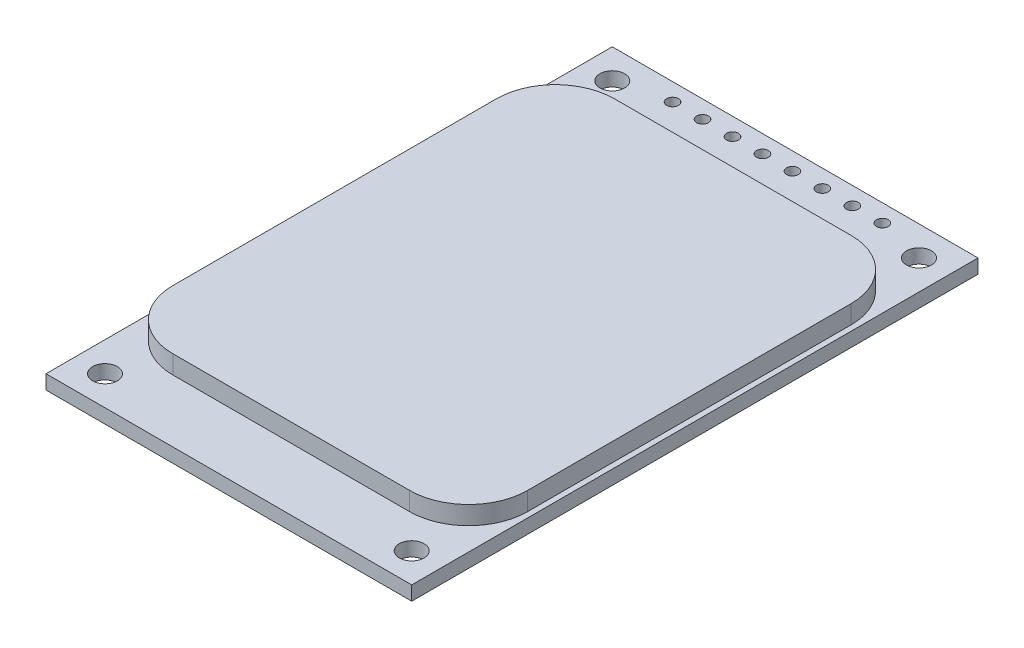
from build123d import *

# Parameters (mm, degrees)
SKETCH_1_W          = 31
SKETCH_1_H          = 48
EXTRUDE_1_DEPTH     = 1.2
CUT_EXTRUDE_1_REACH = 59.153
SKETCH_2_R          = 1.05
CUT_EXTRUDE_2_REACH = 59.153
SKETCH_3_R          = 0.5
SKETCH_4_W          = 30.07
SKETCH_4_H          = 37.43
EXTRUDE_2_DEPTH     = 1.56
FILLET_1_R          = 5


with BuildPart() as part:
    # 草图1 → 凸台-拉伸1 (new body)
    with BuildSketch(Plane(origin=(0, 0, 0), x_dir=(1, 0, 0), z_dir=(0, 1, 0))):
        with Locations((15.5, -24)):
            Rectangle(SKETCH_1_W, SKETCH_1_H)
    extrude(amount=EXTRUDE_1_DEPTH)

    # 草图2 → 切除-拉伸1 (cut, up to next)
    with BuildSketch(Plane(origin=(0, 1.2, 0), x_dir=(1, 0, 0), z_dir=(0, 1, 0)), mode=Mode.PRIVATE) as cut_extrude_1_sk1:
        with Locations(Location((2.5, -2.5, 0), (0, 0, 270))):
            Circle(SKETCH_2_R)
    cut_extrude_1_tool1 = extrude(cut_extrude_1_sk1.sketch, amount=-CUT_EXTRUDE_1_REACH, mode=Mode.PRIVATE) & part.part
    # 草图2 → 切除-拉伸1 (cut, up to next)
    with BuildSketch(Plane(origin=(0, 1.2, 0), x_dir=(1, 0, 0), z_dir=(0, 1, 0)), mode=Mode.PRIVATE) as cut_extrude_1_sk2:
        with Locations(Location((28.5, -2.5, 0), (0, 0, 270))):
            Circle(SKETCH_2_R)
    cut_extrude_1_tool2 = extrude(cut_extrude_1_sk2.sketch, amount=-CUT_EXTRUDE_1_REACH, mode=Mode.PRIVATE) & part.part
    # 草图2 → 切除-拉伸1 (cut, up to next)
    with BuildSketch(Plane(origin=(0, 1.2, 0), x_dir=(1, 0, 0), z_dir=(0, 1, 0)), mode=Mode.PRIVATE) as cut_extrude_1_sk3:
        with Locations(Location((2.5, -45.5, 0), (0, 0, 270))):
            Circle(SKETCH_2_R)
    cut_extrude_1_tool3 = extrude(cut_extrude_1_sk3.sketch, amount=-CUT_EXTRUDE_1_REACH, mode=Mode.PRIVATE) & part.part
    # 草图2 → 切除-拉伸1 (cut, up to next)
    with BuildSketch(Plane(origin=(0, 1.2, 0), x_dir=(1, 0, 0), z_dir=(0, 1, 0)), mode=Mode.PRIVATE) as cut_extrude_1_sk4:
        with Locations(Location((28.5, -45.5, 0), (0, 0, 270))):
            Circle(SKETCH_2_R)
    cut_extrude_1_tool4 = extrude(cut_extrude_1_sk4.sketch, amount=-CUT_EXTRUDE_1_REACH, mode=Mode.PRIVATE) & part.part
    add(cut_extrude_1_tool1.solids().sort_by_distance((2.5, 1.2, 2.5))[0], mode=Mode.SUBTRACT)
    add(cut_extrude_1_tool2.solids().sort_by_distance((28.5, 1.2, 2.5))[0], mode=Mode.SUBTRACT)
    add(cut_extrude_1_tool3.solids().sort_by_distance((2.5, 1.2, 45.5))[0], mode=Mode.SUBTRACT)
    add(cut_extrude_1_tool4.solids().sort_by_distance((28.5, 1.2, 45.5))[0], mode=Mode.SUBTRACT)

    # 草图3 → 切除-拉伸2 (cut, up to next)
    with BuildSketch(Plane(origin=(0, 1.2, 0), x_dir=(1, 0, 0), z_dir=(0, 1, 0)), mode=Mode.PRIVATE) as cut_extrude_2_sk1:
        with Locations(Location((14.23, -1.5, 0), (0, 0, 270))):
            Circle(SKETCH_3_R)
    cut_extrude_2_tool1 = extrude(cut_extrude_2_sk1.sketch, amount=-CUT_EXTRUDE_2_REACH, mode=Mode.PRIVATE) & part.part
    # 草图3 → 切除-拉伸2 (cut, up to next)
    with BuildSketch(Plane(origin=(0, 1.2, 0), x_dir=(1, 0, 0), z_dir=(0, 1, 0)), mode=Mode.PRIVATE) as cut_extrude_2_sk2:
        with Locations(Location((11.69, -1.5, 0), (0, 0, 270))):
            Circle(SKETCH_3_R)
    cut_extrude_2_tool2 = extrude(cut_extrude_2_sk2.sketch, amount=-CUT_EXTRUDE_2_REACH, mode=Mode.PRIVATE) & part.part
    # 草图3 → 切除-拉伸2 (cut, up to next)
    with BuildSketch(Plane(origin=(0, 1.2, 0), x_dir=(1, 0, 0), z_dir=(0, 1, 0)), mode=Mode.PRIVATE) as cut_extrude_2_sk3:
        with Locations(Location((9.15, -1.5, 0), (0, 0, 270))):
            Circle(SKETCH_3_R)
    cut_extrude_2_tool3 = extrude(cut_extrude_2_sk3.sketch, amount=-CUT_EXTRUDE_2_REACH, mode=Mode.PRIVATE) & part.part
    # 草图3 → 切除-拉伸2 (cut, up to next)
    with BuildSketch(Plane(origin=(0, 1.2, 0), x_dir=(1, 0, 0), z_dir=(0, 1, 0)), mode=Mode.PRIVATE) as cut_extrude_2_sk4:
        with Locations(Location((6.61, -1.5, 0), (0, 0, 270))):
            Circle(SKETCH_3_R)
    cut_extrude_2_tool4 = extrude(cut_extrude_2_sk4.sketch, amount=-CUT_EXTRUDE_2_REACH, mode=Mode.PRIVATE) & part.part
    # 草图3 → 切除-拉伸2 (cut, up to next)
    with BuildSketch(Plane(origin=(0, 1.2, 0), x_dir=(1, 0, 0), z_dir=(0, 1, 0)), mode=Mode.PRIVATE) as cut_extrude_2_sk5:
        with Locations(Location((24.39, -1.5, 0), (0, 0, 270))):
            Circle(SKETCH_3_R)
    cut_extrude_2_tool5 = extrude(cut_extrude_2_sk5.sketch, amount=-CUT_EXTRUDE_2_REACH, mode=Mode.PRIVATE) & part.part
    # 草图3 → 切除-拉伸2 (cut, up to next)
    with BuildSketch(Plane(origin=(0, 1.2, 0), x_dir=(1, 0, 0), z_dir=(0, 1, 0)), mode=Mode.PRIVATE) as cut_extrude_2_sk6:
        with Locations(Location((21.85, -1.5, 0), (0, 0, 270))):
            Circle(SKETCH_3_R)
    cut_extrude_2_tool6 = extrude(cut_extrude_2_sk6.sketch, amount=-CUT_EXTRUDE_2_REACH, mode=Mode.PRIVATE) & part.part
    # 草图3 → 切除-拉伸2 (cut, up to next)
    with BuildSketch(Plane(origin=(0, 1.2, 0), x_dir=(1, 0, 0), z_dir=(0, 1, 0)), mode=Mode.PRIVATE) as cut_extrude_2_sk7:
        with Locations(Location((19.31, -1.5, 0), (0, 0, 270))):
            Circle(SKETCH_3_R)
    cut_extrude_2_tool7 = extrude(cut_extrude_2_sk7.sketch, amount=-CUT_EXTRUDE_2_REACH, mode=Mode.PRIVATE) & part.part
    # 草图3 → 切除-拉伸2 (cut, up to next)
    with BuildSketch(Plane(origin=(0, 1.2, 0), x_dir=(1, 0, 0), z_dir=(0, 1, 0)), mode=Mode.PRIVATE) as cut_extrude_2_sk8:
        with Locations(Location((16.77, -1.5, 0), (0, 0, 270))):
            Circle(SKETCH_3_R)
    cut_extrude_2_tool8 = extrude(cut_extrude_2_sk8.sketch, amount=-CUT_EXTRUDE_2_REACH, mode=Mode.PRIVATE) & part.part
    add(cut_extrude_2_tool1.solids().sort_by_distance((14.23, 1.2, 1.5))[0], mode=Mode.SUBTRACT)
    add(cut_extrude_2_tool2.solids().sort_by_distance((11.69, 1.2, 1.5))[0], mode=Mode.SUBTRACT)
    add(cut_extrude_2_tool3.solids().sort_by_distance((9.15, 1.2, 1.5))[0], mode=Mode.SUBTRACT)
    add(cut_extrude_2_tool4.solids().sort_by_distance((6.61, 1.2, 1.5))[0], mode=Mode.SUBTRACT)
    add(cut_extrude_2_tool5.solids().sort_by_distance((24.39, 1.2, 1.5))[0], mode=Mode.SUBTRACT)
    add(cut_extrude_2_tool6.solids().sort_by_distance((21.85, 1.2, 1.5))[0], mode=Mode.SUBTRACT)
    add(cut_extrude_2_tool7.solids().sort_by_distance((19.31, 1.2, 1.5))[0], mode=Mode.SUBTRACT)
    add(cut_extrude_2_tool8.solids().sort_by_distance((16.77, 1.2, 1.5))[0], mode=Mode.SUBTRACT)

    # 草图4 → 凸台-拉伸2 (add)
    with BuildSketch(Plane(origin=(0, 1.2, 0), x_dir=(1, 0, 0), z_dir=(0, 1, 0))):
        with Locations((15.5, -24)):
            Rectangle(SKETCH_4_W, SKETCH_4_H)
    extrude(amount=EXTRUDE_2_DEPTH)

    # 圆角1
    fillet_1_edges = [part.edges().sort_by_distance(p)[0] for p in [
        (0.465, 1.98, 5.285),
        (0.465, 1.98, 42.715),
        (30.535, 1.98, 42.715),
        (30.535, 1.98, 5.285),
    ]]
    fillet(fillet_1_edges, radius=FILLET_1_R)


solid = part.part
